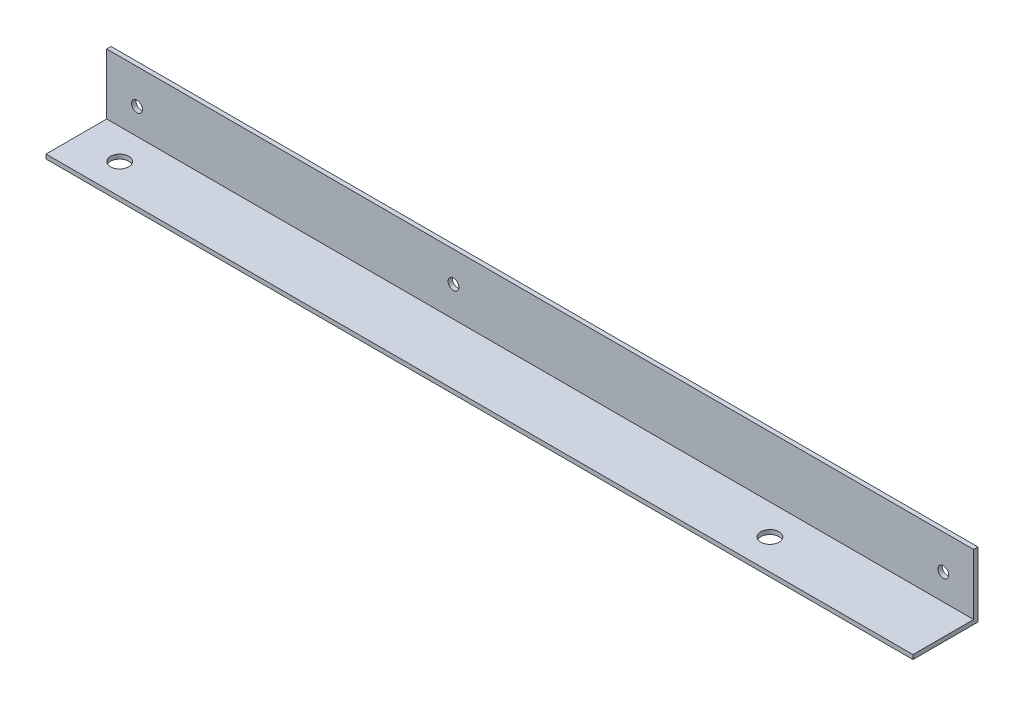
from build123d import *

# Parameters (mm, degrees)
SKETCH_1_W      = 200
SKETCH_1_H      = 15
EXTRUDE_1_DEPTH = 1
SKETCH_2_W      = 200
SKETCH_2_H      = 1
EXTRUDE_2_DEPTH = 14
M5X0_8_1_D      = 4.2
M3X0_5_1_D      = 2.5
M3X0_5_2_D      = 2.5


with BuildPart() as part:
    # ｽｹｯﾁ1 → ﾎﾞｽ - 押し出し1 (new body)
    with BuildSketch(Plane.XY):
        with Locations((100, 7.5)):
            Rectangle(SKETCH_1_W, SKETCH_1_H)
    extrude(amount=EXTRUDE_1_DEPTH)

    # ｽｹｯﾁ2 → ﾎﾞｽ - 押し出し2 (add)
    with BuildSketch(Plane.XY.offset(1)):
        with Locations((100, 0.5)):
            Rectangle(SKETCH_2_W, SKETCH_2_H)
    extrude(amount=EXTRUDE_2_DEPTH)

    # M5x0.8 ねじ穴1 (through all)
    with Locations(Plane(origin=(0, 0, 0), x_dir=(-1, 0, 0), z_dir=(0, -1, 0))):
        with Locations((-10, -8), (-160, -8)):
            Hole(M5X0_8_1_D / 2)

    # M3x0.5 ねじ穴1 (through all)
    with Locations(Plane(origin=(0, 0, 0), x_dir=(-1, 0, 0), z_dir=(0, 0, -1))):
        with Locations((-193, 7)):
            m3x0_5_1 = Hole(M3X0_5_1_D / 2)

    # M3x0.5 ねじ穴2 (through all)
    with Locations(Plane.XY.offset(1)):
        with Locations((80, 8)):
            Hole(M3X0_5_2_D / 2)

    # ﾐﾗｰ1: M3x0.5 ねじ穴1 across plane
    add(m3x0_5_1.mirror(Plane(origin=(100, 0, 0), x_dir=(0, 0, 1), z_dir=(1, 0, 0))), mode=Mode.SUBTRACT)


solid = part.part
